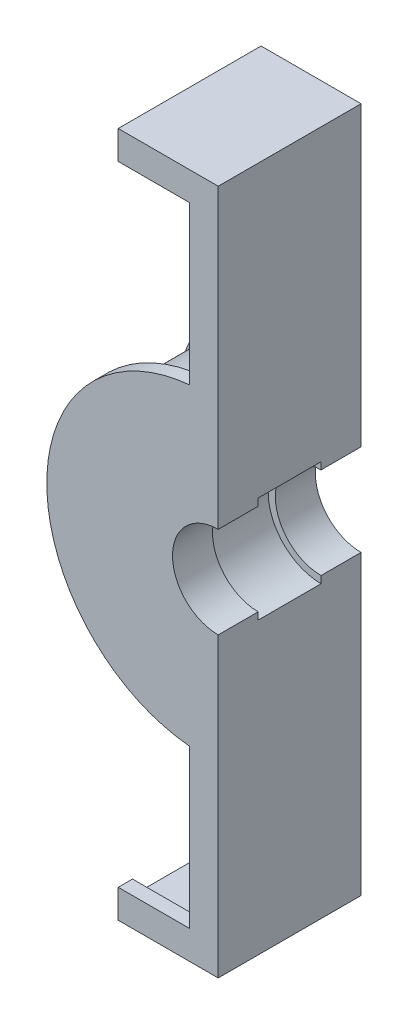
from build123d import *

# Parameters (mm, degrees)
SALIENTE_EXTRUIR1_DEPTH = 40
SALIENTE_EXTRUIR2_DEPTH = 5
SALIENTE_EXTRUIR3_DEPTH = 50
SALIENTE_EXTRUIR4_DEPTH = 14


with BuildPart() as part:
    # Croquis1 → Saliente-Extruir1 (new body)
    with BuildSketch(Plane.XY):
        with BuildLine():
            Line((0, 50), (0, 115))
            Line((0, 115), (-30, 115))
            Line((-30, 115), (-30, 120))
            Line((-30, 120), (5, 120))
            Line((5, 120), (5, 45))
            Line((5, 45), (0, 45))
            ThreePointArc((0, 45), (-45, 0), (0, -45))
            Line((0, -45), (5, -45))
            Line((5, -45), (5, -120))
            Line((5, -120), (-30, -120))
            Line((-30, -120), (-30, -115))
            Line((-30, -115), (0, -115))
            Line((0, -115), (0, -50))
            ThreePointArc((0, -50), (-50, 0), (0, 50))
        make_face()
    extrude(amount=SALIENTE_EXTRUIR1_DEPTH)

    # Croquis2 → Saliente-Extruir2 (add)
    with BuildSketch(Plane.XY.offset(40)):
        with BuildLine():
            Line((5, 120), (-30, 120))
            Line((-30, 120), (-30, 110))
            Line((-30, 110), (-5, 110))
            Line((-5, 110), (-5, 54.772255751))
            ThreePointArc((-5, 54.772255751), (-55, 0), (-5, -54.772255751))
            Line((-5, -54.772255751), (-5, -110))
            Line((-5, -110), (-30, -110))
            Line((-30, -110), (-30, -120))
            Line((-30, -120), (5, -120))
            Line((5, -120), (5, -45))
            Line((5, -45), (0, -45))
            ThreePointArc((0, -45), (-45, 0), (0, 45))
            Line((0, 45), (5, 45))
            Line((5, 45), (5, 120))
        make_face()
    saliente_extruir2 = extrude(amount=SALIENTE_EXTRUIR2_DEPTH)

    # Simetría1: Saliente-Extruir2 across plane
    add(saliente_extruir2.mirror(Plane.XY.offset(20)))

    # Croquis3 → Saliente-Extruir3 (add)
    with BuildSketch(Plane(origin=(0, 0, -5), x_dir=(-1, 0, 0), z_dir=(0, 0, -1))):
        with BuildLine():
            Line((-5, 45.111824995), (-5, 18.5))
            ThreePointArc((-5, 18.5), (13.5, 0), (-5, -18.5))
            Line((-5, -18.5), (-5, -44.72135955))
            Line((-5, -44.72135955), (-5, -45))
            Line((-5, -45), (0, -45))
            ThreePointArc((0, -45), (45, 0), (0, 45))
            Line((0, 45), (-5, 45.111824995))
        make_face()
    extrude(amount=-SALIENTE_EXTRUIR3_DEPTH)

    # Croquis4 → Saliente-Extruir4 (add)
    with BuildSketch(Plane(origin=(0, 0, -5), x_dir=(-1, 0, 0), z_dir=(0, 0, -1))):
        with BuildLine():
            Line((-5, 18.5), (-5, 16))
            ThreePointArc((-5, 16), (11, 0), (-5, -16))
            Line((-5, -16), (-5, -18.5))
            ThreePointArc((-5, -18.5), (13.5, 0), (-5, 18.5))
        make_face()
    saliente_extruir4 = extrude(amount=-SALIENTE_EXTRUIR4_DEPTH)

    # Simetría2: Saliente-Extruir4 across plane
    add(saliente_extruir4.mirror(Plane.XY.offset(20)))


solid = part.part
